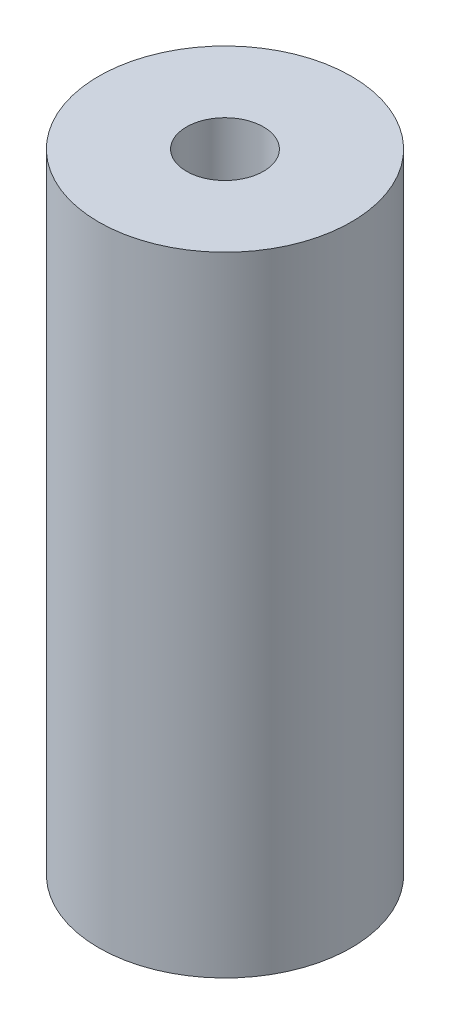
from build123d import *

# Parameters (mm, degrees)
SKETCH1_R           = 2.05
SKETCH1_R_2         = 0.625
BOSS_EXTRUDE1_DEPTH = 10.2


with BuildPart() as part:
    # Sketch1 → Boss-Extrude1 (new body)
    with BuildSketch(Plane(origin=(0, 0, 0), x_dir=(1, 0, 0), z_dir=(0, 1, 0))):
        with Locations(Location((0, 0, 0), (0, 0, 270))):
            Circle(SKETCH1_R)
        with Locations(Location((0, 0, 0), (0, 0, 270))):
            Circle(SKETCH1_R_2, mode=Mode.SUBTRACT)
    extrude(amount=BOSS_EXTRUDE1_DEPTH)


solid = part.part
